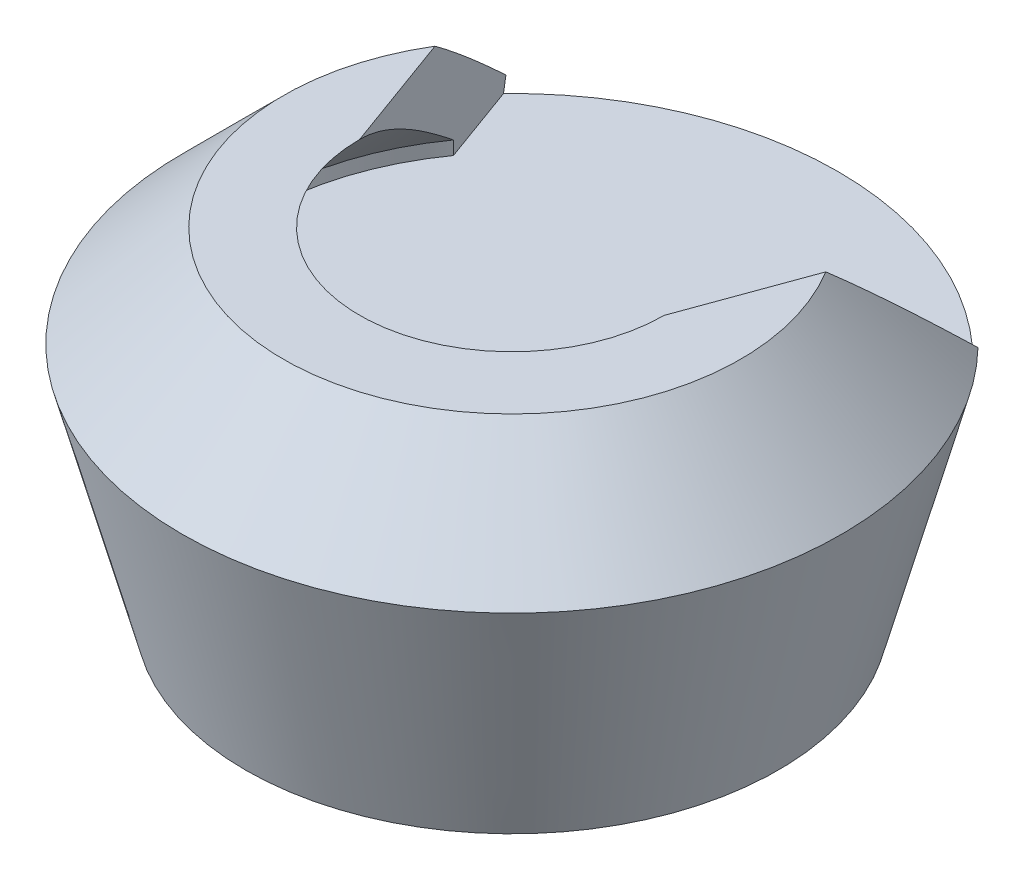
from build123d import *

# Parameters (mm, degrees)
SKETCH8_R           = 12.426789642
BOSS_EXTRUDE3_DEPTH = 8.89
BOSS_EXTRUDE3_TAPER = 15
SKETCH9_R           = 9.553107684
CUT_EXTRUDE1_DEPTH  = 0.508
CUT_EXTRUDE4_REACH  = 23.683


with BuildPart() as part:
    # Sketch7 → Revolve1 (revolve)
    with BuildSketch(Plane.XY, mode=Mode.PRIVATE) as revolve1_sk:
        Polygon((9.553107684, 0), (5.743107684, 3.81), (8.616789642, 3.81), (12.426789642, 0), align=None)
    revolve(revolve1_sk.sketch.rotate(Axis((0, 0, 0), (0, 1, 0)), 90), axis=Axis((0, 0, 0), (0, 1, 0)))

    # Sketch8 → Boss-Extrude3 (add)
    with BuildSketch(Plane.XZ):
        Circle(SKETCH8_R)
    extrude(amount=BOSS_EXTRUDE3_DEPTH, taper=BOSS_EXTRUDE3_TAPER)

    # Sketch9 → Cut-Extrude1 (cut)
    with BuildSketch(Plane(origin=(0, 0, 0), x_dir=(1, 0, 0), z_dir=(0, 1, 0))):
        with Locations(Location((0, 0, 0), (0, 0, 270))):
            Circle(SKETCH9_R)
    extrude(amount=-CUT_EXTRUDE1_DEPTH, mode=Mode.SUBTRACT)

    # Cut-Extrude4: up to this face of the body (flat: up to its plane)
    cut_extrude4_end = Plane(part.part.faces().sort_by_distance((0, -0.508, 0))[0])
    # Sketch13 → Cut-Extrude4 (cut, up to the picked face)
    with BuildSketch(Plane(origin=(0, 3.81, 0), x_dir=(1, 0, 0), z_dir=(0, 1, 0)), mode=Mode.PRIVATE) as cut_extrude4_sk1:
        with BuildLine():
            Line((-5.743107684, 0), (-8.89978102, 8.672888712))
            ThreePointArc((-8.89978102, 8.672888712), (0, 12.426789642), (8.89978102, 8.672888712))
            Line((8.89978102, 8.672888712), (5.743107684, 0))
            ThreePointArc((5.743107684, 0), (0, 5.743107684), (-5.743107684, 0))
        make_face()
    cut_extrude4_tool1 = split(extrude(cut_extrude4_sk1.sketch, amount=-CUT_EXTRUDE4_REACH, mode=Mode.PRIVATE), bisect_by=cut_extrude4_end, keep=Keep.BOTH, mode=Mode.PRIVATE)
    add(cut_extrude4_tool1.solids().sort_by(Axis((0, 3.81, -7.700849), (0, -1, 0)))[0], mode=Mode.SUBTRACT)


solid = part.part
